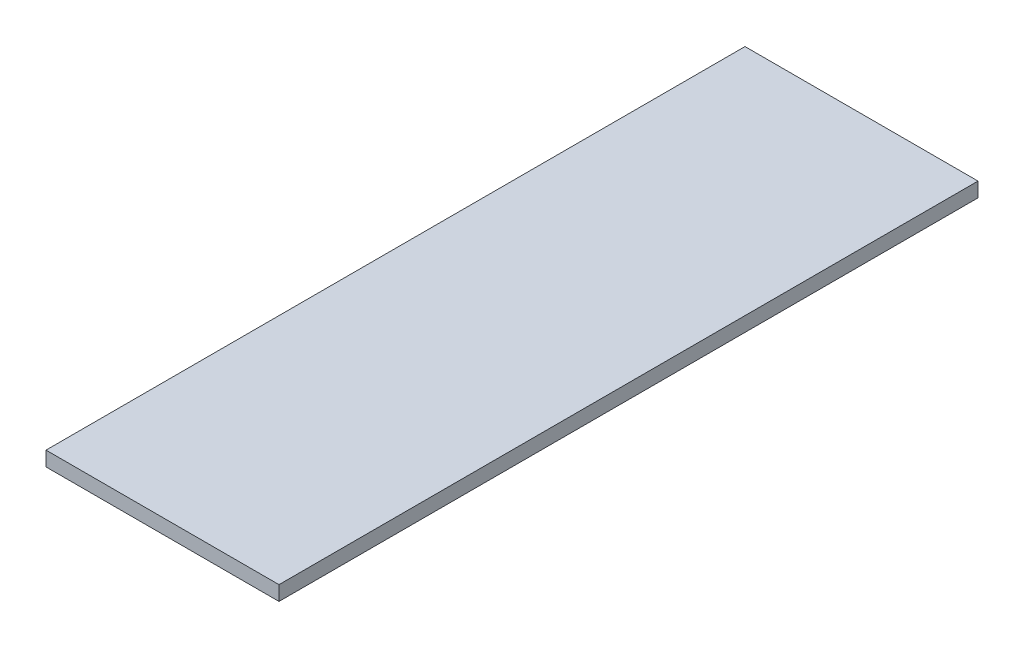
from build123d import *

# Parameters (mm, degrees)
SKETCH1_W           = 12.7
SKETCH1_H           = 38.1
BOSS_EXTRUDE1_DEPTH = 0.79375


with BuildPart() as part:
    # Sketch1 → Boss-Extrude1 (new body)
    with BuildSketch(Plane(origin=(0, 0, 0), x_dir=(1, 0, 0), z_dir=(0, 1, 0))):
        Rectangle(SKETCH1_W, SKETCH1_H)
    extrude(amount=BOSS_EXTRUDE1_DEPTH)


solid = part.part
